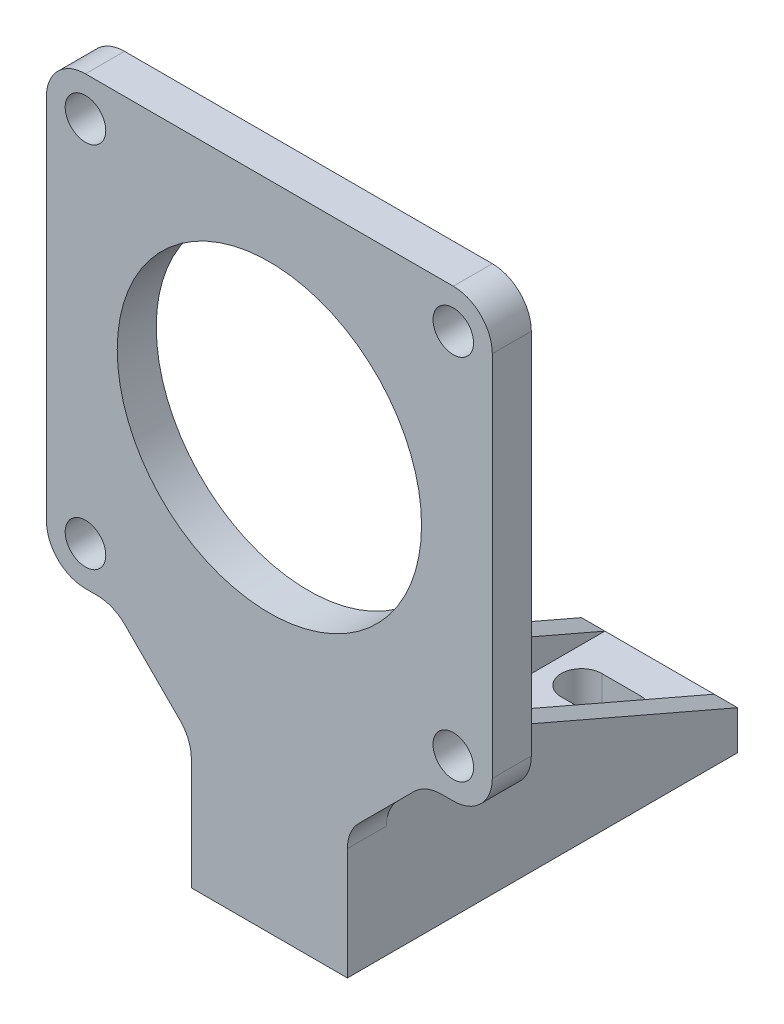
from build123d import *

# Parameters (mm, degrees)
SKETCH1_W           = 57.14
SKETCH1_H           = 57.14
SKETCH1_R           = 19.5
SKETCH1_R_2         = 2.6
SKETCH1_W_2         = 20
SKETCH1_H_2         = 26.43
BOSS_EXTRUDE1_DEPTH = 5
SKETCH3_W           = 45
SKETCH3_H           = 5
BOSS_EXTRUDE2_DEPTH = 20
BOSS_EXTRUDE3_START = -7.5
BOSS_EXTRUDE3_DEPTH = 5
CUT_EXTRUDE1_REACH  = 96.945
FILLET1_R           = 5
CHAMFER1_SIZE       = 4
CHAMFER2_SIZE       = 10
FILLET2_R           = 5
BOSS_EXTRUDE4_DEPTH = 3


with BuildPart() as part:
    # Sketch1 → Boss-Extrude1 (new body)
    # profile 1 of 2: a face of its own
    with BuildSketch(Plane.XY):
        Rectangle(SKETCH1_W, SKETCH1_H)
        Circle(SKETCH1_R, mode=Mode.SUBTRACT)
        with Locations((-23.57, -23.57)):
            Circle(SKETCH1_R_2, mode=Mode.SUBTRACT)
        with Locations((23.57, -23.57)):
            Circle(SKETCH1_R_2, mode=Mode.SUBTRACT)
        with Locations((23.57, 23.57)):
            Circle(SKETCH1_R_2, mode=Mode.SUBTRACT)
        with Locations((-23.57, 23.57)):
            Circle(SKETCH1_R_2, mode=Mode.SUBTRACT)
    # profile 2 of 2: a face of its own
    with BuildSketch(Plane.XY):
        with Locations((0, -41.785)):
            Rectangle(SKETCH1_W_2, SKETCH1_H_2)
    extrude(amount=BOSS_EXTRUDE1_DEPTH)

    # Sketch3 → Boss-Extrude2 (add)
    with BuildSketch(Plane(origin=(10, 0, 0), x_dir=(0, 0, -1), z_dir=(1, 0, 0))):
        with Locations((22.5, -52.5)):
            Rectangle(SKETCH3_W, SKETCH3_H)
    extrude(amount=-BOSS_EXTRUDE2_DEPTH)

    # Sketch5 → Boss-Extrude3 (add)
    with BuildSketch(Plane(origin=(10, 0, 0), x_dir=(0, 0, -1), z_dir=(1, 0, 0)).offset(BOSS_EXTRUDE3_START)):
        Polygon((0, -35), (15, -50), (0, -50), align=None)
    extrude(amount=-BOSS_EXTRUDE3_DEPTH)

    # Sketch4 → Cut-Extrude1 (cut, up to next)
    with BuildSketch(Plane(origin=(0, -50, 0), x_dir=(1, 0, 0), z_dir=(0, 1, 0)), mode=Mode.PRIVATE) as cut_extrude1_sk1:
        with BuildLine():
            Line((-2.5, 40.1), (2.5, 40.1))
            ThreePointArc((2.5, 40.1), (5.1, 37.5), (2.5, 34.9))
            Line((2.5, 34.9), (-2.5, 34.9))
            ThreePointArc((-2.5, 34.9), (-5.1, 37.5), (-2.5, 40.1))
        make_face()
    cut_extrude1_tool1 = extrude(cut_extrude1_sk1.sketch, amount=-CUT_EXTRUDE1_REACH, mode=Mode.PRIVATE) & part.part
    # Sketch4 → Cut-Extrude1 (cut, up to next)
    with BuildSketch(Plane(origin=(0, -50, 0), x_dir=(1, 0, 0), z_dir=(0, 1, 0)), mode=Mode.PRIVATE) as cut_extrude1_sk2:
        with BuildLine():
            Line((-2.5, 25.1), (2.5, 25.1))
            ThreePointArc((2.5, 25.1), (5.1, 22.5), (2.5, 19.9))
            Line((2.5, 19.9), (-2.5, 19.9))
            ThreePointArc((-2.5, 19.9), (-5.1, 22.5), (-2.5, 25.1))
        make_face()
    cut_extrude1_tool2 = extrude(cut_extrude1_sk2.sketch, amount=-CUT_EXTRUDE1_REACH, mode=Mode.PRIVATE) & part.part
    add(cut_extrude1_tool1.solids().sort_by_distance((0, -50, -37.5))[0], mode=Mode.SUBTRACT)
    add(cut_extrude1_tool2.solids().sort_by_distance((0, -50, -22.5))[0], mode=Mode.SUBTRACT)

    # Fillet1
    fillet1_edges = [part.edges().sort_by_distance(p)[0] for p in [
        (28.57, -28.57, 2.5),
        (-28.57, -28.57, 2.5),
        (-28.57, 28.57, 2.5),
        (28.57, 28.57, 2.5),
    ]]
    fillet(fillet1_edges, radius=FILLET1_R)

    # Chamfer1
    chamfer1_edges = [part.edges().sort_by_distance(p)[0] for p in [
        (-6.25, -50, 0),
        (6.25, -50, 0),
    ]]
    chamfer(chamfer1_edges, length=CHAMFER1_SIZE)

    # Chamfer2
    chamfer2_edges = [part.edges().sort_by_distance(p)[0] for p in [
        (10, -28.57, 2.5),
        (-10, -28.57, 2.5),
    ]]
    chamfer(chamfer2_edges, length=CHAMFER2_SIZE)

    # Fillet2
    fillet2_edges = [part.edges().sort_by_distance(p)[0] for p in [
        (-10, -38.57, 2.5),
        (-20, -28.57, 2.5),
        (20, -28.57, 2.5),
        (10, -38.57, 2.5),
    ]]
    fillet(fillet2_edges, radius=FILLET2_R)

    # Sketch6 → Boss-Extrude4 (add)
    with BuildSketch(Plane(origin=(10, 0, 0), x_dir=(0, 0, -1), z_dir=(1, 0, 0))):
        Polygon((45, -50), (4, -50), (0, -46), (0, -30.534466094), align=None)
    boss_extrude4 = extrude(amount=-BOSS_EXTRUDE4_DEPTH)

    # Mirror1: Boss-Extrude4 across plane
    add(boss_extrude4.mirror(Plane(origin=(0, 0, 0), x_dir=(0, 0, 1), z_dir=(1, 0, 0))))


solid = part.part
